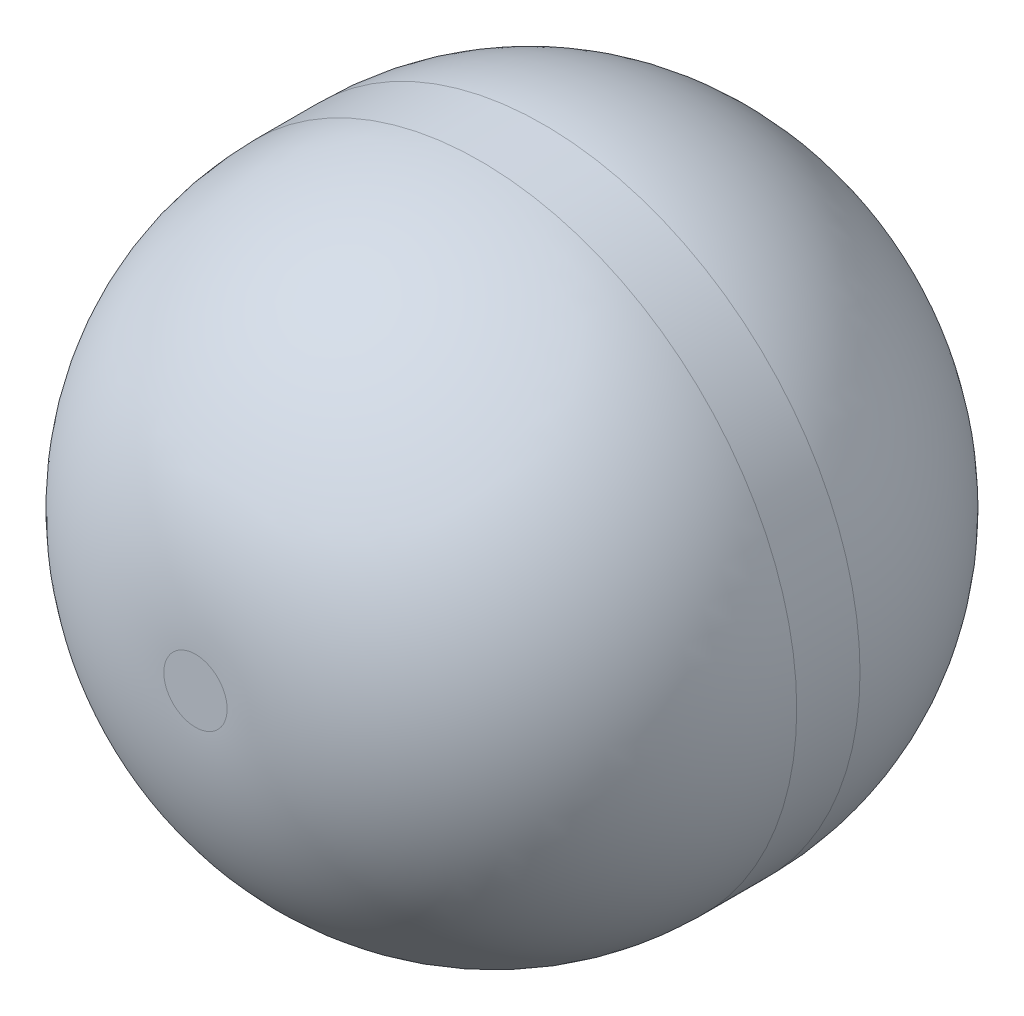
from build123d import *

# Parameters (mm, degrees)
SKETCH1_R           = 50
BOSS_EXTRUDE1_DEPTH = 50
FILLET1_R           = 45


with BuildPart() as part:
    # Sketch1 → Boss-Extrude1 (new, symmetric)
    with BuildSketch(Plane.XY):
        Circle(SKETCH1_R)
    extrude(amount=BOSS_EXTRUDE1_DEPTH, both=True)

    # Fillet1
    fillet1_edges = [part.edges().sort_by_distance(p)[0] for p in [
        (-50, 0, -50),
        (-50, 0, 50),
    ]]
    fillet(fillet1_edges, radius=FILLET1_R)


solid = part.part
